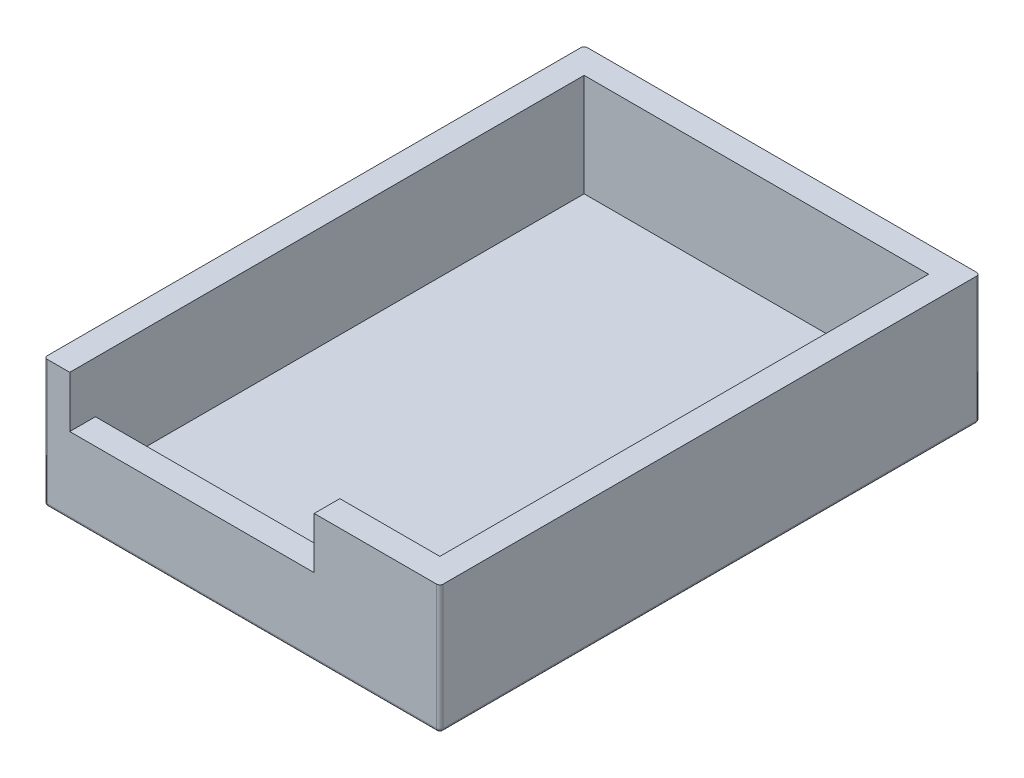
from build123d import *

# Parameters (mm, degrees)
SKETCH1_W           = 30.86
SKETCH1_H           = 42.11
BOSS_EXTRUDE1_DEPTH = 10
SHELL2_T            = -2
SKETCH4_W           = 19.06
SKETCH4_H           = 2
CUT_EXTRUDE1_DEPTH  = 4
FILLET1_R           = 0.25
SKETCH5_R           = 1.5
CUT_EXTRUDE2_DEPTH  = 28.953495756
SKETCH6_R           = 1.5
CUT_EXTRUDE3_DEPTH  = 28.953495756


with BuildPart() as part:
    # Sketch1 → Boss-Extrude1 (new body)
    with BuildSketch(Plane(origin=(0, 0, 0), x_dir=(1, 0, 0), z_dir=(0, 1, 0))):
        Rectangle(SKETCH1_W, SKETCH1_H)
    extrude(amount=BOSS_EXTRUDE1_DEPTH)

    # Shell2
    shell2_openings = [part.faces().sort_by_distance(p)[0] for p in [
        (0, 10, 0),
    ]]
    offset(amount=SHELL2_T, openings=shell2_openings, kind=Kind.INTERSECTION)

    # Sketch4 → Cut-Extrude1 (cut)
    with BuildSketch(Plane(origin=(0, 10, 0), x_dir=(1, 0, 0), z_dir=(0, 1, 0))):
        with Locations((-3.9, -20.055)):
            Rectangle(SKETCH4_W, SKETCH4_H)
    extrude(amount=-CUT_EXTRUDE1_DEPTH, mode=Mode.SUBTRACT)

    # Fillet1
    fillet1_edges = [part.edges().sort_by_distance(p)[0] for p in [
        (0, 0, 21.055),
        (-15.43, 0, 0),
        (0, 0, -21.055),
        (15.43, 0, 0),
        (15.43, 5, 21.055),
        (-15.43, 5, 21.055),
        (-15.43, 5, -21.055),
        (15.43, 5, -21.055),
    ]]
    fillet(fillet1_edges, radius=FILLET1_R)

    # Sketch5 → Cut-Extrude2 (cut, through all)
    with BuildSketch(Plane.XZ):
        with Locations(Location((3.955545026, 15.646822422, 0), (0, 0, 270))):
            Circle(SKETCH5_R)
    extrude(amount=-CUT_EXTRUDE2_DEPTH, mode=Mode.SUBTRACT)

    # Sketch6 → Cut-Extrude3 (cut, through all)
    with BuildSketch(Plane.XZ):
        with Locations(Location((8.578599531, 12.725824803, 0), (0, 0, 270))):
            Circle(SKETCH6_R)
    extrude(amount=-CUT_EXTRUDE3_DEPTH, mode=Mode.SUBTRACT)


solid = part.part
